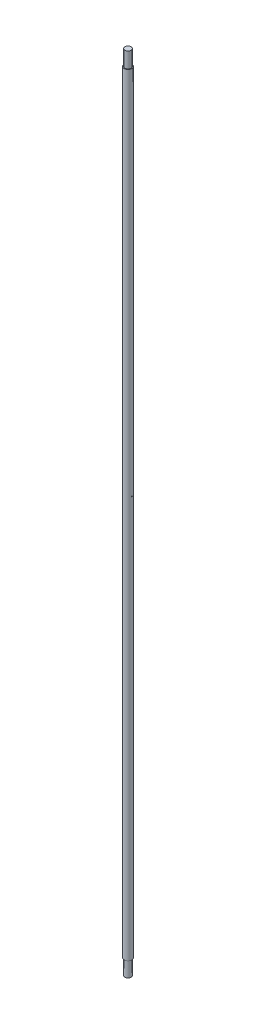
from build123d import *

# Parameters (mm, degrees)
ESQUISSE1_R        = 5
BOSS_EXTRU_1_DEPTH = 1000
ESQUISSE2_R        = 4
BOSS_EXTRU_2_DEPTH = 20
BOSS_EXTRU_3_START = 20
ESQUISSE3_R        = 4
BOSS_EXTRU_3_DEPTH = 20
D_GAGEMENT_M11_D   = 1.2


with BuildPart() as part:
    # Esquisse1 → Boss.-Extru.1 (new body)
    with BuildSketch(Plane(origin=(0, 0, 0), x_dir=(1, 0, 0), z_dir=(0, 1, 0))):
        with Locations(Location((0, 0, 0), (0, 0, 270))):
            Circle(ESQUISSE1_R)
    extrude(amount=BOSS_EXTRU_1_DEPTH)

    # Esquisse2 → Boss.-Extru.2 (add)
    with BuildSketch(Plane(origin=(0, 1000, 0), x_dir=(1, 0, 0), z_dir=(0, 1, 0))):
        with Locations(Location((0, 0, 0), (0, 0, 270))):
            Circle(ESQUISSE2_R)
    extrude(amount=BOSS_EXTRU_2_DEPTH)

    # Esquisse3 → Boss.-Extru.3 (add)
    with BuildSketch(Plane(origin=(0, 0, 0), x_dir=(-1, 0, 0), z_dir=(0, -1, 0)).offset(BOSS_EXTRU_3_START)):
        with Locations(Location((0, 0, 0), (0, 0, 270))):
            Circle(ESQUISSE3_R)
    extrude(amount=-BOSS_EXTRU_3_DEPTH)

    # Dégagement M11 (through all)
    with Locations(Plane(origin=(5, 520, 0), x_dir=(0, 0, 1), z_dir=(1, 0, 0))):
        with Locations((0, 0)):
            Hole(D_GAGEMENT_M11_D / 2)


solid = part.part
